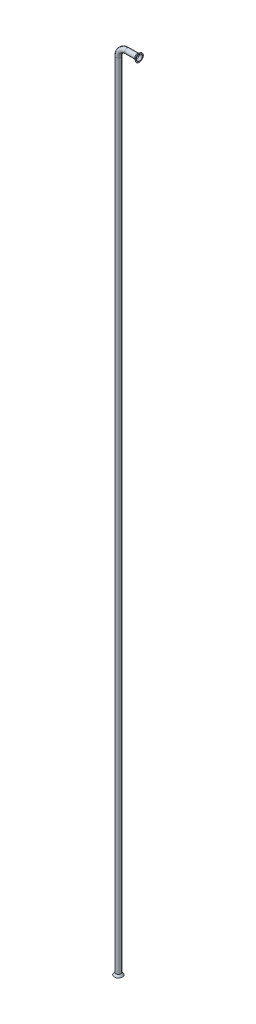
from build123d import *

# Parameters (mm, degrees)
SKETCH1_R           = 3.175
SKETCH1_R_2         = 1.9304
SKETCH3_R           = 3.175
BOSS_EXTRUDE1_DEPTH = 2.54
BOSS_EXTRUDE1_DRAFT = -37
SKETCH5_R           = 3.175
BOSS_EXTRUDE2_DEPTH = 2.54
BOSS_EXTRUDE2_DRAFT = -37


with BuildPart() as part:
    # Sweep1: sweep along a path in Sketch2
    with BuildLine(Plane.XY) as sweep1_path:
        Line((0, 0), (0, 1004.7224))
        ThreePointArc((0, 1004.7224), (3.303132564, 1012.696867436), (11.2776, 1016))
        Line((11.2776, 1016), (23.9776, 1016))
    # Sketch1 → Sweep1 (sweep)
    with BuildSketch(Plane(origin=(0, 0, 0), x_dir=(1, 0, 0), z_dir=(0, 1, 0))):
        Circle(SKETCH1_R)
        Circle(SKETCH1_R_2, mode=Mode.SUBTRACT)
    sweep(path=sweep1_path.line)


with BuildPart() as boss_extrude1_tool:
    # Sketch3 → Boss-Extrude1 (with draft: the straight prism first)
    with BuildSketch(Plane.XZ):
        with Locations(Location((0, 0, 0), (0, 0, 180))):
            Circle(SKETCH3_R)
    extrude(amount=BOSS_EXTRUDE1_DEPTH)
    # Boss-Extrude1: the draft: its side faces are tilted about the plane it starts from
    boss_extrude1_sides = [boss_extrude1_tool.faces().sort_by_distance(p)[0] for p in [
        (3.175, -1.27, 0),
    ]]
    draft(boss_extrude1_sides, Plane.XZ, BOSS_EXTRUDE1_DRAFT)


with BuildPart() as part_1:
    add(part.part)

    # Boss-Extrude1: add boss_extrude1_tool
    add(boss_extrude1_tool.part)

    # Cut-Extrude1 cone 1 section (through the dimple's axis) → Cut-Extrude1 (revolve, cut)
    with BuildSketch(Plane(origin=(0, -2.54, 0), x_dir=(0, 0, -1), z_dir=(1, 0, 0))):
        Polygon((0, 0), (3.844427287, 0), (0, 5.101727324), align=None)
    revolve(axis=Axis((0, -2.54, 0), (0, 1, 0)), mode=Mode.SUBTRACT)


with BuildPart() as boss_extrude2_tool:
    # Sketch5 → Boss-Extrude2 (with draft: the straight prism first)
    with BuildSketch(Plane(origin=(23.9776, 0, 0), x_dir=(0, 0, -1), z_dir=(1, 0, 0))):
        with Locations(Location((0, 1016, 0), (0, 0, 90))):
            Circle(SKETCH5_R)
    extrude(amount=BOSS_EXTRUDE2_DEPTH)
    # Boss-Extrude2: the draft: its side faces are tilted about the plane it starts from
    boss_extrude2_sides = [boss_extrude2_tool.faces().sort_by_distance(p)[0] for p in [
        (25.2476, 1012.825, 0),
    ]]
    draft(boss_extrude2_sides, Plane(origin=(23.9776, 0, 0), x_dir=(0, 0, -1), z_dir=(1, 0, 0)), BOSS_EXTRUDE2_DRAFT)


with BuildPart() as part_2:
    add(part_1.part)

    # Boss-Extrude2: add boss_extrude2_tool
    add(boss_extrude2_tool.part)

    # Cut-Extrude2 cone 1 section (through the dimple's axis) → Cut-Extrude2 (revolve, cut)
    with BuildSketch(Plane(origin=(26.5176, 1016, 0), x_dir=(0, 0, -1), z_dir=(0, 1, 0))):
        Polygon((0, 0), (3.844427287, 0), (0, 5.101727324), align=None)
    revolve(axis=Axis((26.5176, 1016, 0), (-1, 0, 0)), mode=Mode.SUBTRACT)


solid = part_2.part
